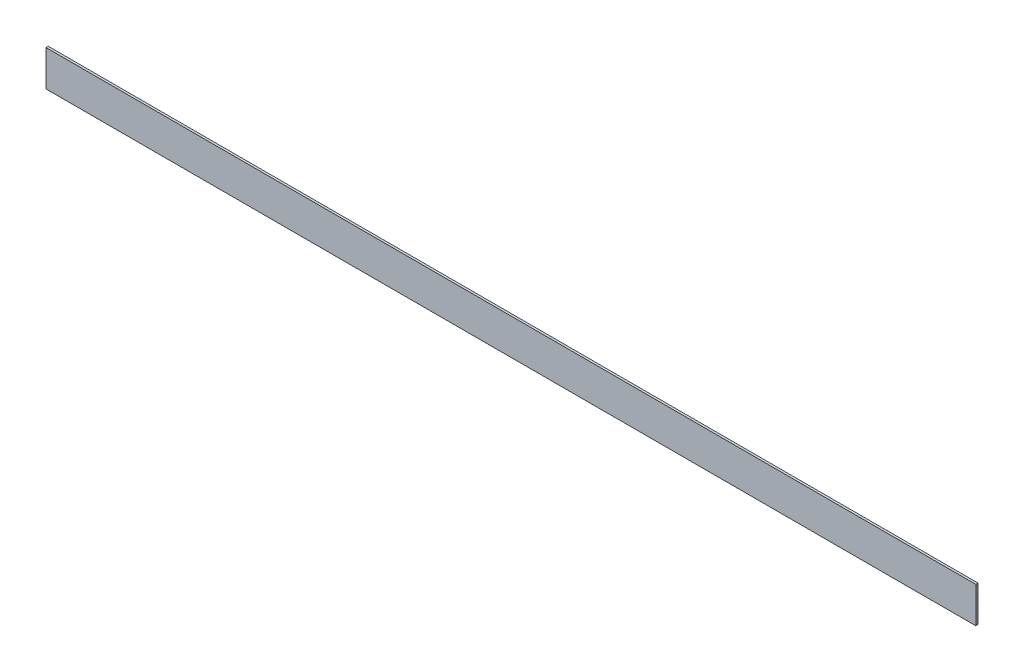
from build123d import *

# Parameters (mm, degrees)
SKETCH1_W           = 526.542
SKETCH1_H           = 20.32
BOSS_EXTRUDE1_DEPTH = 1.27


with BuildPart() as part:
    # Sketch1 → Boss-Extrude1 (new body)
    with BuildSketch(Plane.XY):
        with Locations((215.154650569, 4.05052807)):
            Rectangle(SKETCH1_W, SKETCH1_H)
    extrude(amount=BOSS_EXTRUDE1_DEPTH)


solid = part.part
